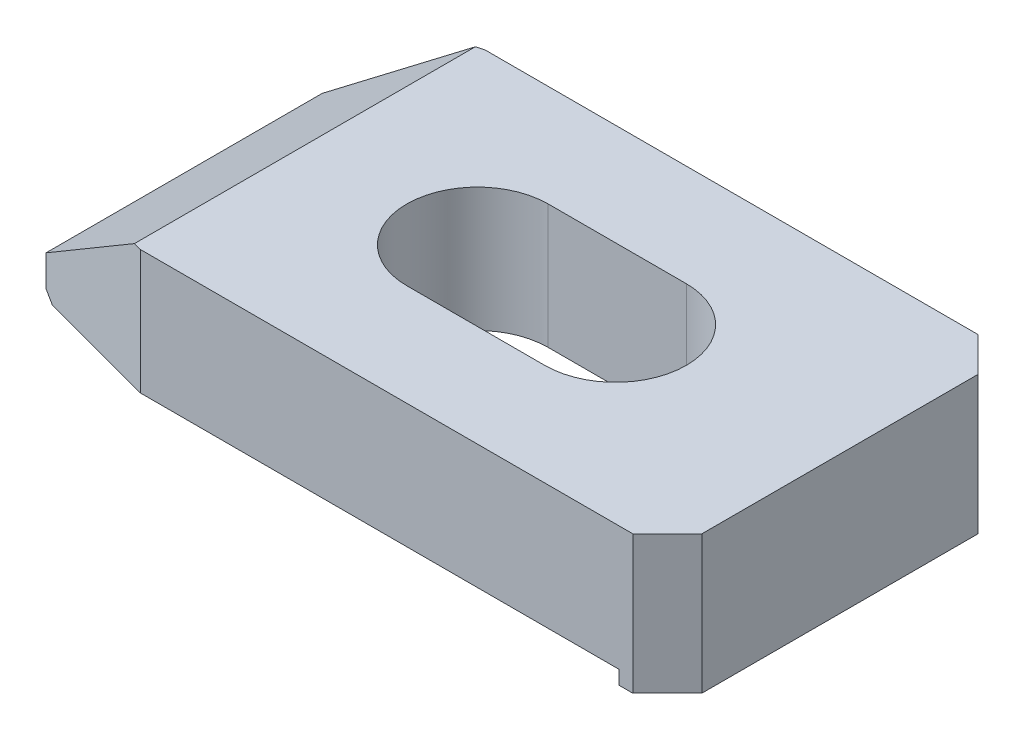
from build123d import *

# Parameters (mm, degrees)
SKETCH1_W           = 19
SKETCH1_H           = 10
BOSS_EXTRUDE1_DEPTH = 2
CHAMFER2_SIZE       = 1
SKETCH2_W           = 17.6
SKETCH2_H           = 10
CUT_EXTRUDE4_DEPTH  = 0.4
CUT_EXTRUDE5_DEPTH  = 21.049937656
CHAMFER4_SIZE       = 3.5
CHAMFER4_SIZE2      = 2.450726384
CHAMFER5_SIZE       = 0.25


with BuildPart() as part:
    # Sketch1 → Boss-Extrude1 (new, symmetric)
    with BuildSketch(Plane(origin=(0, 0, 0), x_dir=(1, 0, 0), z_dir=(0, 1, 0))):
        with Locations((9.5, 0)):
            Rectangle(SKETCH1_W, SKETCH1_H)
        with BuildLine():
            Line((8.5, 2.05), (12.5, 2.05))
            ThreePointArc((12.5, 2.05), (14.55, 0), (12.5, -2.05))
            Line((12.5, -2.05), (8.5, -2.05))
            ThreePointArc((8.5, -2.05), (6.45, 0), (8.5, 2.05))
        make_face(mode=Mode.SUBTRACT)
    extrude(amount=BOSS_EXTRUDE1_DEPTH, both=True)

    # Chamfer2
    chamfer2_edges = [part.edges().sort_by_distance(p)[0] for p in [
        (19, 0, -5),
        (19, 0, 5),
    ]]
    chamfer(chamfer2_edges, length=CHAMFER2_SIZE)

    # Sketch2 → Cut-Extrude4 (cut)
    with BuildSketch(Plane(origin=(0, -2, 0), x_dir=(1, 0, 0), z_dir=(0, 1, 0))):
        with Locations((8.8, 0)):
            Rectangle(SKETCH2_W, SKETCH2_H)
    extrude(amount=CUT_EXTRUDE4_DEPTH, mode=Mode.SUBTRACT)

    # Sketch5 → Cut-Extrude5 (cut, through all)
    with BuildSketch(Plane(origin=(0, 2, 0), x_dir=(1, 0, 0), z_dir=(0, 1, 0))):
        Polygon((0, 4), (3.732050808, 5), (0, 5), align=None)
        Polygon((0, -4), (0, -5), (3.732050808, -5), align=None)
    extrude(amount=-CUT_EXTRUDE5_DEPTH, mode=Mode.SUBTRACT)

    # Chamfer4
    chamfer4_edges = [part.edges().sort_by_distance(p)[0] for p in [
        (0, 2, 0),
    ]]
    chamfer4_side = [part.faces().sort_by_distance(p)[0] for p in [
        (1.921596209, 2, -4.29260693),
    ]]
    chamfer(chamfer4_edges, length=CHAMFER4_SIZE, length2=CHAMFER4_SIZE2, reference=chamfer4_side[0])

    # Chamfer5
    chamfer5_edges = [part.edges().sort_by_distance(p)[0] for p in [
        (0, -1.6, 0),
    ]]
    chamfer(chamfer5_edges, length=CHAMFER5_SIZE)


solid = part.part
